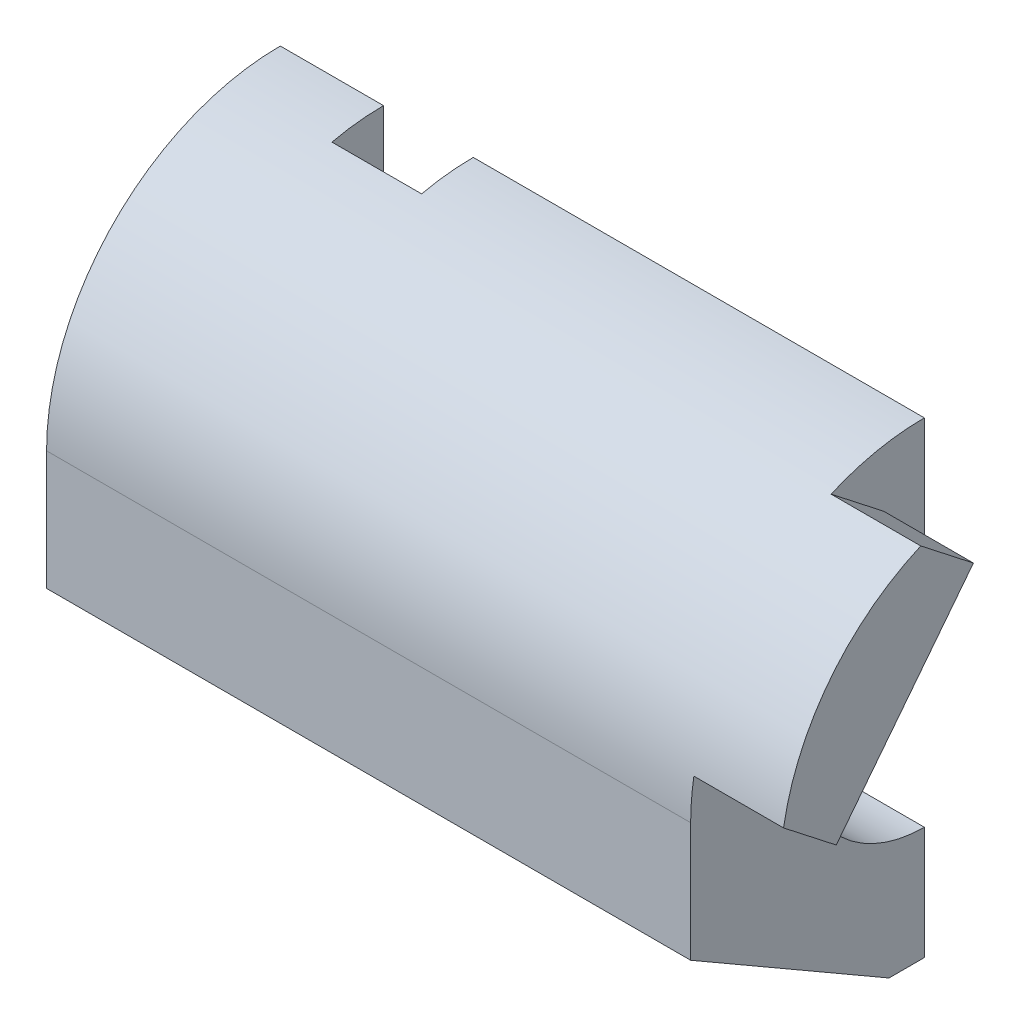
from build123d import *

# Parameters (mm, degrees)
EXTRUDE_9_DEPTH     = 237
CUT_EXTRUDE_3_DEPTH = 78
SKETCH_12_W         = 13
SKETCH_12_H         = 22
CUT_EXTRUDE_5_DEPTH = 110
SKETCH_13_R         = 11
CUT_EXTRUDE_6_DEPTH = 13
SKETCH_14_W         = 33
SKETCH_14_H         = 63.965487913
CUT_EXTRUDE_9_DEPTH = 19
EXTRUDE_START       = 33
EXTRUDE_11_DEPTH    = 33


with BuildPart() as part:
    # 草图1 → 凸台-拉伸9 (new body)
    with BuildSketch(Plane(origin=(0, 0, 0), x_dir=(0, 0, -1), z_dir=(1, 0, 0))):
        with BuildLine():
            Line((0, 172), (0, 114.575))
            ThreePointArc((0, 114.575), (-28.575, 86), (0, 57.425))
            Line((0, 57.425), (0, 0))
            Line((0, 0), (-13, 0))
            Line((-13, 0), (-86, 42.146569651))
            Line((-86, 42.146569651), (-86, 86))
            ThreePointArc((-86, 86), (-60.811183182, 146.811183182), (0, 172))
        make_face()
    extrude(amount=-EXTRUDE_9_DEPTH)

    # 草图1<13> → 切除-拉伸3 (cut)
    with BuildSketch(Plane(origin=(0, 0, 0), x_dir=(0, 0, -1), z_dir=(1, 0, 0))):
        with BuildLine():
            Line((0, 114.575), (0, 130.45))
            ThreePointArc((0, 130.45), (-44.45, 86), (0, 41.55))
            Line((0, 41.55), (0, 57.425))
            ThreePointArc((0, 57.425), (-28.575, 86), (0, 114.575))
        make_face()
    extrude(amount=-CUT_EXTRUDE_3_DEPTH, mode=Mode.SUBTRACT)

    # 草图12 → 切除-拉伸5 (cut)
    with BuildSketch(Plane.ZY.offset(237)):
        with Locations((6.5, 26)):
            Rectangle(SKETCH_12_W, SKETCH_12_H)
    extrude(amount=-CUT_EXTRUDE_5_DEPTH, mode=Mode.SUBTRACT)

    # 草图13 → 切除-拉伸6 (cut)
    with BuildSketch(Plane(origin=(0, 0, 0), x_dir=(-1, 0, 0), z_dir=(0, 0, -1))):
        with Locations((127, 26)):
            Circle(SKETCH_13_R)
    extrude(amount=-CUT_EXTRUDE_6_DEPTH, mode=Mode.SUBTRACT)

    # 草图14 → 切除-拉伸9 (cut)
    with BuildSketch(Plane(origin=(0, 0, 0), x_dir=(-1, 0, 0), z_dir=(0, 0, -1))):
        with Locations((182.5, 140.017256043)):
            Rectangle(SKETCH_14_W, SKETCH_14_H)
    extrude(amount=-CUT_EXTRUDE_9_DEPTH, mode=Mode.SUBTRACT)

    # 草图10 → 凸台-拉伸11 (add)
    with BuildSketch(Plane(origin=(0, 0, 0), x_dir=(0, 0, -1), z_dir=(1, 0, 0)).offset(EXTRUDE_START)):
        with BuildLine():
            Line((-84.813857215, 100.234100753), (-65.430668922, 85.090294344))
            Line((-65.430668922, 85.090294344), (-14.946427946, 149.707176139))
            Line((-14.946427946, 149.707176139), (-34.329616239, 164.850982549))
            ThreePointArc((-34.329616239, 164.850982549), (-67.76892481, 138.946886878), (-84.813857215, 100.234100753))
        make_face()
    extrude(amount=-EXTRUDE_11_DEPTH)


solid = part.part
